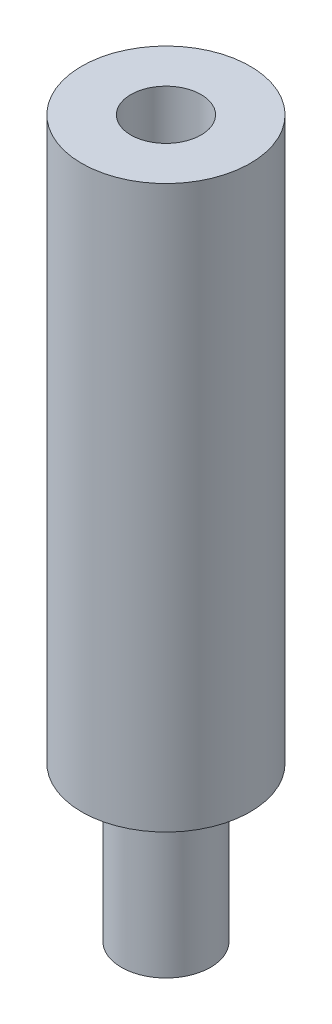
from build123d import *

# Parameters (mm, degrees)
SKETCH1_R           = 1.5875
SKETCH1_R_2         = 0.5
BOSS_EXTRUDE1_DEPTH = 5.5
SKETCH2_R           = 2
SKETCH2_R_2         = 1.5875
BOSS_EXTRUDE2_DEPTH = 0.25
SKETCH3_R           = 3
SKETCH3_R_2         = 0.5
BOSS_EXTRUDE3_DEPTH = 20
SKETCH4_R           = 1.25
CUT_EXTRUDE1_DEPTH  = 10


with BuildPart() as part:
    # Sketch1 → Boss-Extrude1 (new body)
    with BuildSketch(Plane(origin=(0, 0, 0), x_dir=(1, 0, 0), z_dir=(0, 1, 0))):
        with Locations(Location((0, 0, 0), (0, 0, 270))):
            Circle(SKETCH1_R)
        with Locations(Location((0, 0, 0), (0, 0, 270))):
            Circle(SKETCH1_R_2, mode=Mode.SUBTRACT)
    extrude(amount=BOSS_EXTRUDE1_DEPTH)

    # Sketch2 → Boss-Extrude2 (add)
    with BuildSketch(Plane(origin=(0, 5.25, 0), x_dir=(-1, 0, 0), z_dir=(0, -1, 0))):
        with Locations(Location((0, 0, 0), (0, 0, 90))):
            Circle(SKETCH2_R)
        with Locations(Location((0, 0, 0), (0, 0, 90))):
            Circle(SKETCH2_R_2, mode=Mode.SUBTRACT)
    extrude(amount=-BOSS_EXTRUDE2_DEPTH)

    # Sketch3 → Boss-Extrude3 (add)
    with BuildSketch(Plane(origin=(0, 5.5, 0), x_dir=(1, 0, 0), z_dir=(0, 1, 0))):
        with Locations(Location((0, 0, 0), (0, 0, 270))):
            Circle(SKETCH3_R)
        with Locations(Location((0, 0, 0), (0, 0, 270))):
            Circle(SKETCH3_R_2, mode=Mode.SUBTRACT)
    extrude(amount=BOSS_EXTRUDE3_DEPTH)

    # Sketch4 → Cut-Extrude1 (cut)
    with BuildSketch(Plane(origin=(0, 25.5, 0), x_dir=(1, 0, 0), z_dir=(0, 1, 0))):
        with Locations(Location((0, 0, 0), (0, 0, 270))):
            Circle(SKETCH4_R)
    extrude(amount=-CUT_EXTRUDE1_DEPTH, mode=Mode.SUBTRACT)


solid = part.part
